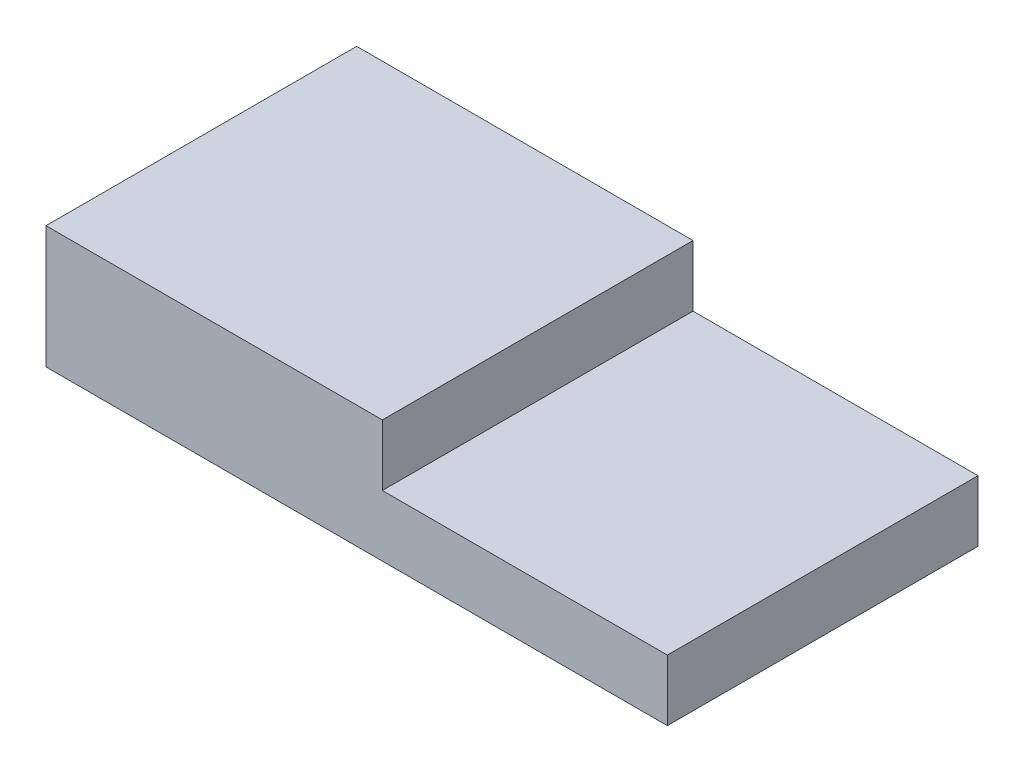
from build123d import *

# Parameters (mm, degrees)
SKETCH1_W           = 101.6
SKETCH1_H           = 50.8
BOSS_EXTRUDE1_DEPTH = 10
SKETCH2_W           = 55
SKETCH2_H           = 50.8
BOSS_EXTRUDE2_DEPTH = 10


with BuildPart() as part:
    # Sketch1 → Boss-Extrude1 (new body)
    with BuildSketch(Plane(origin=(0, 0, 0), x_dir=(1, 0, 0), z_dir=(0, 1, 0))):
        Rectangle(SKETCH1_W, SKETCH1_H)
    extrude(amount=BOSS_EXTRUDE1_DEPTH)

    # Sketch2 → Boss-Extrude2 (add)
    with BuildSketch(Plane(origin=(0, 10, 0), x_dir=(1, 0, 0), z_dir=(0, 1, 0))):
        with Locations((-23.3, 0)):
            Rectangle(SKETCH2_W, SKETCH2_H)
    extrude(amount=BOSS_EXTRUDE2_DEPTH)


solid = part.part
